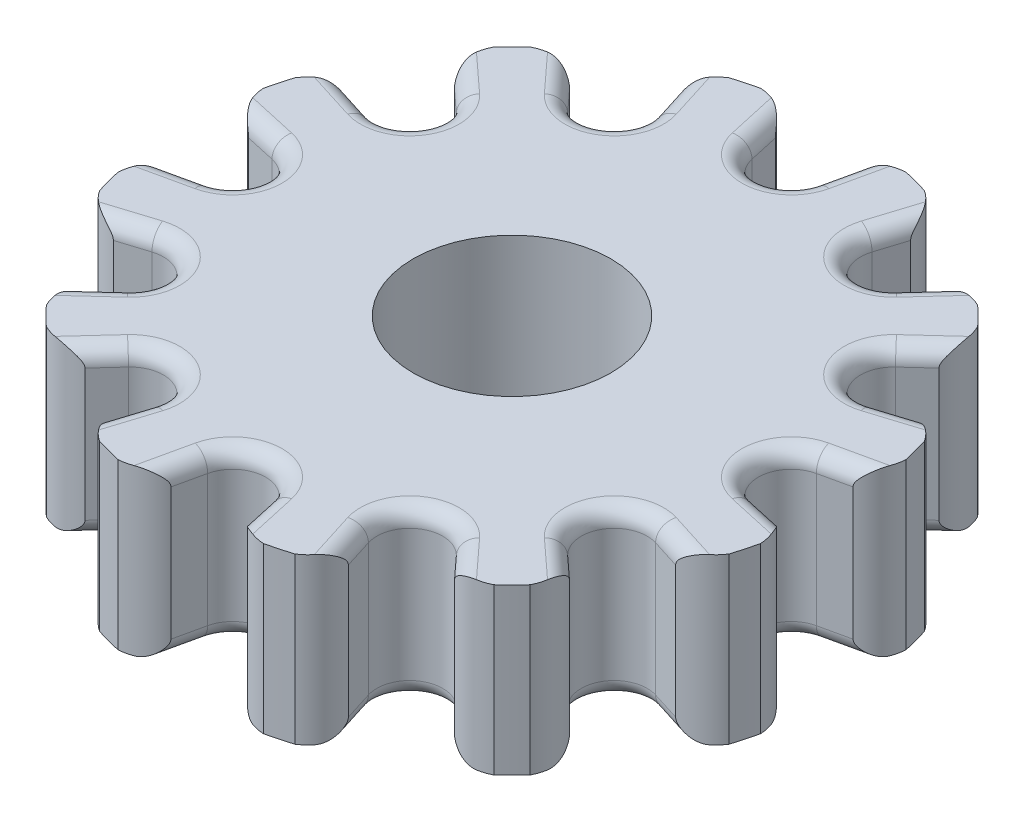
from build123d import *

# Parameters (mm, degrees)
SKETCH2_R                = 20
BOSS_EXTRUDE2_DEPTH      = 5
SKETCH4_R                = 6
CUT_EXTRUDE3_DEPTH       = 10
CUT_EXTRUDE5_DEPTH       = 10
FILLET1_R                = 1
CIRPATTERN3_COUNT        = 12
FILLET1_OF_CIRPATTERN3_R = 1
CUT_EXTRUDE6_DEPTH       = 5
CIRPATTERN4_COUNT        = 12


with BuildPart() as part:
    # Sketch2 → Boss-Extrude2 (new, symmetric)
    with BuildSketch(Plane(origin=(0, 0, 0), x_dir=(1, 0, 0), z_dir=(0, 1, 0))):
        with Locations(Location((0, 0, 0), (0, 0, 270))):
            Circle(SKETCH2_R)
    extrude(amount=BOSS_EXTRUDE2_DEPTH, both=True)

    # Sketch4 → Cut-Extrude3 (cut)
    with BuildSketch(Plane(origin=(0, 5, 0), x_dir=(1, 0, 0), z_dir=(0, 1, 0))):
        with Locations(Location((0, 0, 0), (0, 0, 270))):
            Circle(SKETCH4_R)
    extrude(amount=-CUT_EXTRUDE3_DEPTH, mode=Mode.SUBTRACT)

    # Sketch3 → Cut-Extrude5 (cut)
    with BuildSketch(Plane(origin=(0, 5, 0), x_dir=(1, 0, 0), z_dir=(0, 1, 0))):
        with BuildLine():
            Line((1.952478146, 16.518952502), (2.684980769, 19.818952502))
            ThreePointArc((2.684980769, 19.818952502), (0, 20), (-2.684980769, 19.818952502))
            Line((-2.684980769, 19.818952502), (-1.952478146, 16.518952502))
            ThreePointArc((-1.952478146, 16.518952502), (0, 14.952345036), (1.952478146, 16.518952502))
        make_face()
    cut_extrude5 = extrude(amount=-CUT_EXTRUDE5_DEPTH, mode=Mode.SUBTRACT)

    # Fillet1
    fillet1_edges = [part.edges().sort_by_distance(p)[0] for p in [
        (-2.684980769, 0, -19.818952502),
        (2.318729458, -5, -18.168952502),
        (2.684980769, 0, -19.818952502),
        (0, -5, -14.952345036),
        (-2.318729458, -5, -18.168952502),
        (-2.318729458, 5, -18.168952502),
        (0, 5, -14.952345036),
        (2.318729458, 5, -18.168952502),
    ]]
    fillet(fillet1_edges, radius=FILLET1_R)

    # CirPattern3: Cut-Extrude5 ×12 about axis
    cirpattern3_axis = Axis((0, 0, 0), (0, 1, 0))
    for i in range(1, CIRPATTERN3_COUNT):
        add(cut_extrude5.rotate(cirpattern3_axis, i * 360 / CIRPATTERN3_COUNT), mode=Mode.SUBTRACT)

    # Fillet1 of CirPattern3
    fillet1_of_cirpattern3_edges = [part.edges().sort_by_distance(p)[0] for p in [
        (-12.234737806, 0, -15.821225958),
        (-7.076397636, -5, -16.894139156),
        (-7.584214696, 0, -18.506206728),
        (-7.476172518, -5, -12.949110648),
        (-11.092554866, -5, -14.575409698),
        (-11.092554866, 5, -14.575409698),
        (-7.476172518, 5, -12.949110648),
        (-7.076397636, 5, -16.894139156),
        (-18.506206728, 0, -7.584214696),
        (-14.575409698, -5, -11.092554866),
        (-15.821225958, 0, -12.234737806),
        (-12.949110648, -5, -7.476172518),
        (-16.894139156, -5, -7.076397636),
        (-16.894139156, 5, -7.076397636),
        (-12.949110648, 5, -7.476172518),
        (-14.575409698, 5, -11.092554866),
        (-19.818952502, 0, 2.684980769),
        (-18.168952502, -5, -2.318729458),
        (-19.818952502, 0, -2.684980769),
        (-14.952345036, -5, 0),
        (-18.168952502, -5, 2.318729458),
        (-18.168952502, 5, 2.318729458),
        (-14.952345036, 5, 0),
        (-18.168952502, 5, -2.318729458),
        (-15.821225958, 0, 12.234737806),
        (-16.894139156, -5, 7.076397636),
        (-18.506206728, 0, 7.584214696),
        (-12.949110648, -5, 7.476172518),
        (-14.575409698, -5, 11.092554866),
        (-14.575409698, 5, 11.092554866),
        (-12.949110648, 5, 7.476172518),
        (-16.894139156, 5, 7.076397636),
        (-7.584214696, 0, 18.506206728),
        (-11.092554866, -5, 14.575409698),
        (-12.234737806, 0, 15.821225958),
        (-7.476172518, -5, 12.949110648),
        (-7.076397636, -5, 16.894139156),
        (-7.076397636, 5, 16.894139156),
        (-7.476172518, 5, 12.949110648),
        (-11.092554866, 5, 14.575409698),
        (2.684980769, 0, 19.818952502),
        (-2.318729458, -5, 18.168952502),
        (-2.684980769, 0, 19.818952502),
        (0, -5, 14.952345036),
        (2.318729458, -5, 18.168952502),
        (2.318729458, 5, 18.168952502),
        (0, 5, 14.952345036),
        (-2.318729458, 5, 18.168952502),
        (12.234737806, 0, 15.821225958),
        (7.076397636, -5, 16.894139156),
        (7.584214696, 0, 18.506206728),
        (7.476172518, -5, 12.949110648),
        (11.092554866, -5, 14.575409698),
        (11.092554866, 5, 14.575409698),
        (7.476172518, 5, 12.949110648),
        (7.076397636, 5, 16.894139156),
        (18.506206728, 0, 7.584214696),
        (14.575409698, -5, 11.092554866),
        (15.821225958, 0, 12.234737806),
        (12.949110648, -5, 7.476172518),
        (16.894139156, -5, 7.076397636),
        (16.894139156, 5, 7.076397636),
        (12.949110648, 5, 7.476172518),
        (14.575409698, 5, 11.092554866),
        (19.818952502, 0, -2.684980769),
        (18.168952502, -5, 2.318729458),
        (19.818952502, 0, 2.684980769),
        (14.952345036, -5, 0),
        (18.168952502, -5, -2.318729458),
        (18.168952502, 5, -2.318729458),
        (14.952345036, 5, 0),
        (18.168952502, 5, 2.318729458),
        (15.821225958, 0, -12.234737806),
        (16.894139156, -5, -7.076397636),
        (18.506206728, 0, -7.584214696),
        (12.949110648, -5, -7.476172518),
        (14.575409698, -5, -11.092554866),
        (14.575409698, 5, -11.092554866),
        (12.949110648, 5, -7.476172518),
        (16.894139156, 5, -7.076397636),
        (7.584214696, 0, -18.506206728),
        (11.092554866, -5, -14.575409698),
        (12.234737806, 0, -15.821225958),
        (7.476172518, -5, -12.949110648),
        (7.076397636, -5, -16.894139156),
        (7.076397636, 5, -16.894139156),
        (7.476172518, 5, -12.949110648),
        (11.092554866, 5, -14.575409698),
    ]]
    fillet(fillet1_of_cirpattern3_edges, radius=FILLET1_OF_CIRPATTERN3_R)

    # Sketch5 → Cut-Extrude6 (cut, symmetric)
    with BuildSketch(Plane(origin=(0, 0, 0), x_dir=(1, 0, 0), z_dir=(0, 1, 0))):
        with BuildLine():
            ThreePointArc((1.952478146, 16.518952502), (5.203434808, 19.419483076), (6.568580576, 15.282071584))
            ThreePointArc((6.568580576, 15.282071584), (5.848245641, 21.825949866), (1.952478146, 16.518952502))
        make_face()
    cut_extrude6 = extrude(amount=CUT_EXTRUDE6_DEPTH, both=True, mode=Mode.SUBTRACT)

    # CirPattern4: Cut-Extrude6 ×12 about axis
    cirpattern4_axis = Axis((0, 0, 0), (0, 1, 0))
    for i in range(1, CIRPATTERN4_COUNT):
        add(cut_extrude6.rotate(cirpattern4_axis, i * 360 / CIRPATTERN4_COUNT), mode=Mode.SUBTRACT)


solid = part.part
